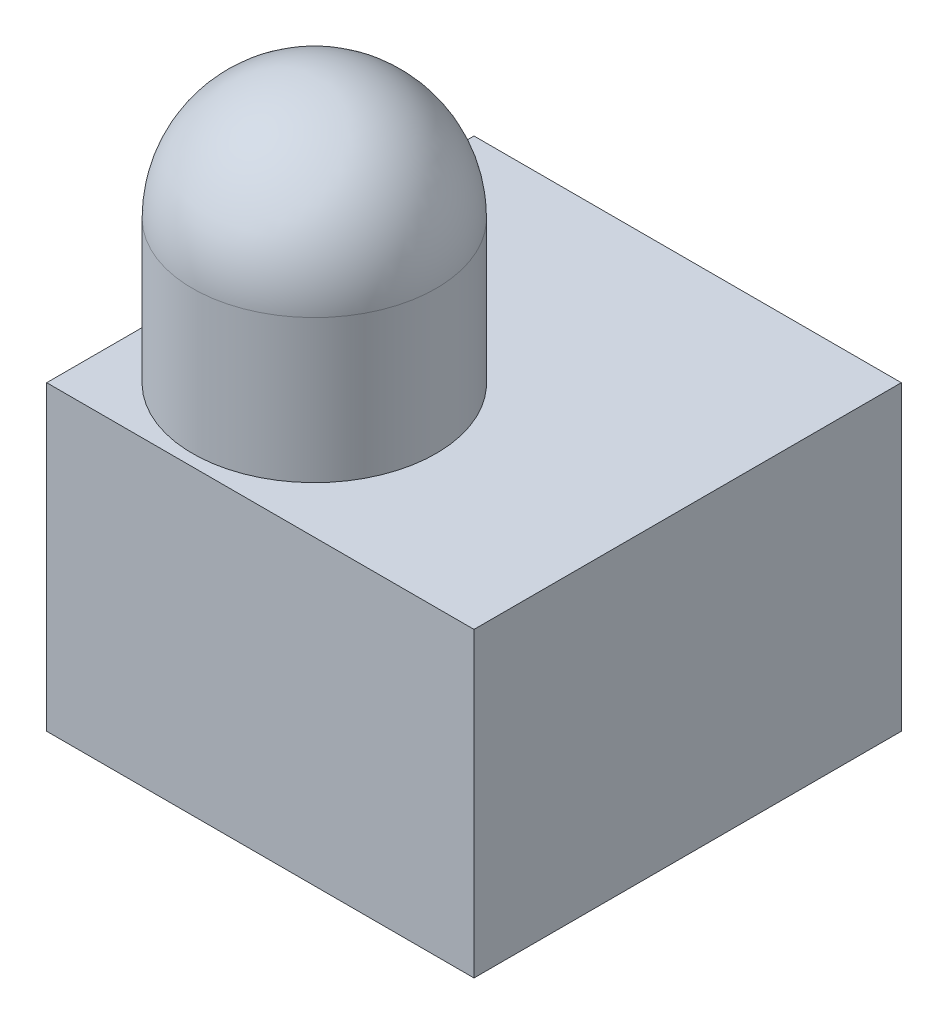
from build123d import *

# Parameters (mm, degrees)
SKETCH1_W           = 233.68
SKETCH1_H           = 233.68
BOSS_EXTRUDE1_DEPTH = 165.1


with BuildPart() as part:
    # Sketch1 → Boss-Extrude1 (new body)
    with BuildSketch(Plane(origin=(0, 0, 0), x_dir=(1, 0, 0), z_dir=(0, 1, 0))):
        Rectangle(SKETCH1_W, SKETCH1_H)
    extrude(amount=BOSS_EXTRUDE1_DEPTH)

    # Sketch3 → Revolve1 (revolve)
    with BuildSketch(Plane.YZ.offset(-43.40946291)):
        with BuildLine():
            Line((165.1, 43.916968586), (309.883452069, 43.916968586))
            ThreePointArc((309.883452069, 43.916968586), (290.37259982, -3.186395526), (243.269235708, -22.697247775))
            Line((243.269235708, -22.697247775), (165.1, -22.697247775))
            Line((165.1, -22.697247775), (165.1, 43.916968586))
        make_face()
    revolve(axis=Axis((-43.40946291, 165.1, 43.916968586), (0, 1, 0)))


solid = part.part
